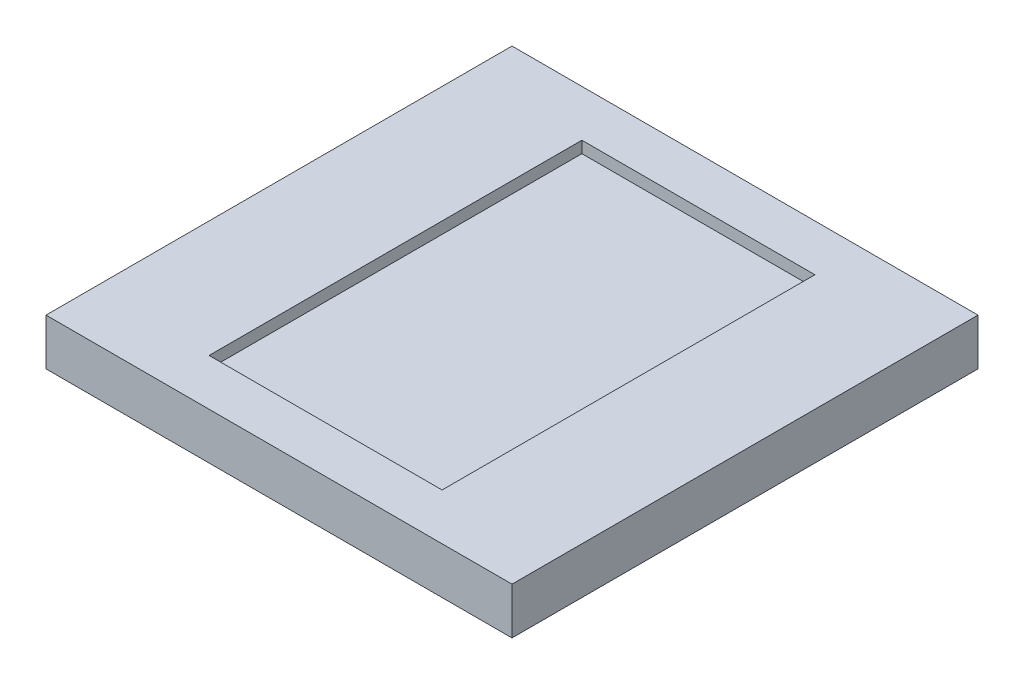
from build123d import *

# Parameters (mm, degrees)
ESQUISSE1_W             = 10
ESQUISSE1_H             = 10
BOSS_EXTRU_1_DEPTH      = 1
ESQUISSE3_W             = 5
ESQUISSE3_H             = 8
ENL_V_MAT_EXTRU_1_DEPTH = 0.25


with BuildPart() as part:
    # Esquisse1 → Boss.-Extru.1 (new body)
    with BuildSketch(Plane(origin=(0, 0, 0), x_dir=(1, 0, 0), z_dir=(0, 1, 0))):
        with Locations((5, 5)):
            Rectangle(ESQUISSE1_W, ESQUISSE1_H)
    extrude(amount=BOSS_EXTRU_1_DEPTH)

    # Esquisse3 → Enlèv. mat.-Extru.1 (cut)
    with BuildSketch(Plane(origin=(0, 1, 0), x_dir=(1, 0, 0), z_dir=(0, 1, 0))):
        with Locations((5, 5)):
            Rectangle(ESQUISSE3_W, ESQUISSE3_H)
    extrude(amount=-ENL_V_MAT_EXTRU_1_DEPTH, mode=Mode.SUBTRACT)


solid = part.part
